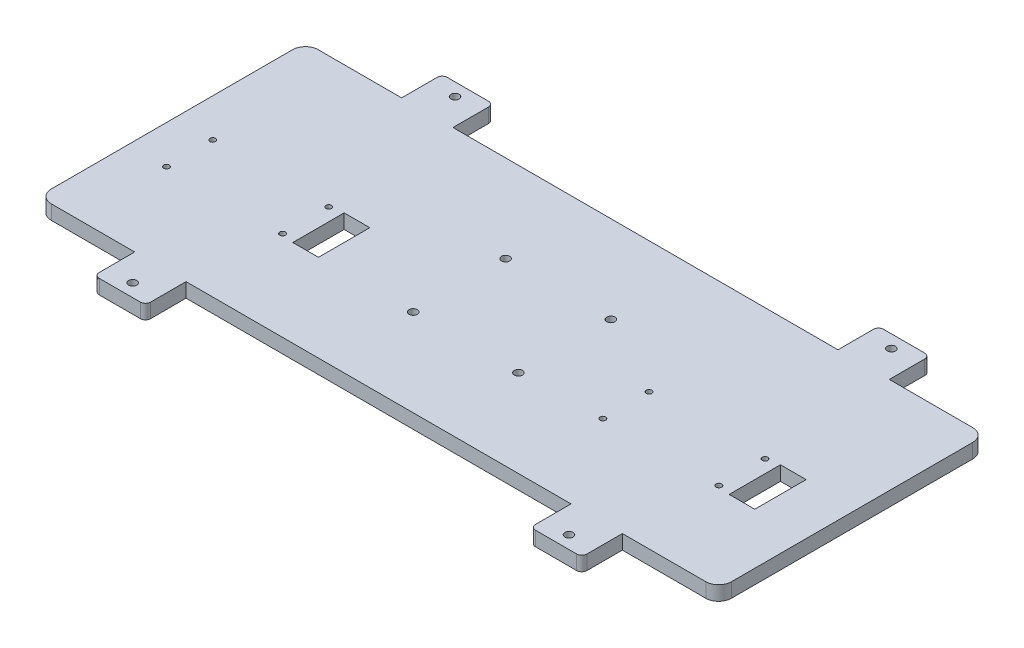
from build123d import *

# Parameters (mm, degrees)
SKETCH_1_W          = 265
SKETCH_1_H          = 104
EXTRUDE_1_DEPTH     = 5.6
SKETCH_2_R          = 1.6
CUT_EXTRUDE_4_DEPTH = 143.448622317
SKETCH_4_R          = 1.1
SKETCH_4_W          = 10
SKETCH_4_H          = 20
CUT_EXTRUDE_6_DEPTH = 143.448622317
SKETCH_5_W          = 20
SKETCH_5_H          = 15.8
SKETCH_5_R          = 1.6
EXTRUDE_2_DEPTH     = 5.6
FILLET_1_R          = 5
FILLET_2_R          = 2


with BuildPart() as part:
    # ｽｹｯﾁ1 → ﾎﾞｽ - 押し出し1 (new body)
    with BuildSketch(Plane(origin=(0, 0, 0), x_dir=(1, 0, 0), z_dir=(0, 1, 0))):
        Rectangle(SKETCH_1_W, SKETCH_1_H)
    extrude(amount=EXTRUDE_1_DEPTH)

    # ｽｹｯﾁ2 → ｶｯﾄ - 押し出し4 (cut, through all)
    with BuildSketch(Plane(origin=(0, 0, 0), x_dir=(1, 0, 0), z_dir=(0, 1, 0))):
        with Locations(Location((20.5, 18, 0), (0, 0, 270))):
            Circle(SKETCH_2_R)
        with Locations(Location((20.5, -18, 0), (0, 0, 90))):
            Circle(SKETCH_2_R)
        with Locations(Location((-20.5, -18, 0), (0, 0, 270))):
            Circle(SKETCH_2_R)
        with Locations(Location((-20.5, 18, 0), (0, 0, 90))):
            Circle(SKETCH_2_R)
    extrude(amount=CUT_EXTRUDE_4_DEPTH, mode=Mode.SUBTRACT)

    # ｽｹｯﾁ4 → ｶｯﾄ - 押し出し6 (cut, through all)
    with BuildSketch(Plane(origin=(0, 5.6, 0), x_dir=(1, 0, 0), z_dir=(0, 1, 0))):
        with Locations(Location((97.6, 1, 0), (0, 0, 270))):
            Circle(SKETCH_4_R)
        with Locations(Location((97.6, -17, 0), (0, 0, 90))):
            Circle(SKETCH_4_R)
        with Locations(Location((52.4, 1, 0), (0, 0, 90))):
            Circle(SKETCH_4_R)
        with Locations(Location((52.4, -17, 0), (0, 0, 270))):
            Circle(SKETCH_4_R)
        with Locations(Location((-72.4, 1, 0), (0, 0, 270))):
            Circle(SKETCH_4_R)
        with Locations(Location((-72.4, -17, 0), (0, 0, 90))):
            Circle(SKETCH_4_R)
        with Locations(Location((-117.6, 1, 0), (0, 0, 90))):
            Circle(SKETCH_4_R)
        with Locations(Location((-117.6, -17, 0), (0, 0, 270))):
            Circle(SKETCH_4_R)
        with Locations((-62.4, -8)):
            Rectangle(SKETCH_4_W, SKETCH_4_H)
        with Locations((107.6, -8)):
            Rectangle(SKETCH_4_W, SKETCH_4_H)
    extrude(amount=-CUT_EXTRUDE_6_DEPTH, mode=Mode.SUBTRACT)

    # ｽｹｯﾁ5 → ﾎﾞｽ - 押し出し2 (add)
    # profile 1 of 4: a face of its own
    with BuildSketch(Plane(origin=(0, 5.6, 0), x_dir=(1, 0, 0), z_dir=(0, 1, 0))):
        with Locations((85, 59.9)):
            Rectangle(SKETCH_5_W, SKETCH_5_H)
        with Locations(Location((85, 62.8, 0), (0, 0, 270))):
            Circle(SKETCH_5_R, mode=Mode.SUBTRACT)
    # profile 2 of 4: a face of its own
    with BuildSketch(Plane(origin=(0, 5.6, 0), x_dir=(1, 0, 0), z_dir=(0, 1, 0))):
        with Locations((-85, 59.9)):
            Rectangle(SKETCH_5_W, SKETCH_5_H)
        with Locations(Location((-85, 62.8, 0), (0, 0, 90))):
            Circle(SKETCH_5_R, mode=Mode.SUBTRACT)
    # profile 3 of 4: a face of its own
    with BuildSketch(Plane(origin=(0, 5.6, 0), x_dir=(1, 0, 0), z_dir=(0, 1, 0))):
        with Locations((85, -59.9)):
            Rectangle(SKETCH_5_W, SKETCH_5_H)
        with Locations(Location((85, -62.8, 0), (0, 0, 90))):
            Circle(SKETCH_5_R, mode=Mode.SUBTRACT)
    # profile 4 of 4: a face of its own
    with BuildSketch(Plane(origin=(0, 5.6, 0), x_dir=(1, 0, 0), z_dir=(0, 1, 0))):
        with Locations((-85, -59.9)):
            Rectangle(SKETCH_5_W, SKETCH_5_H)
        with Locations(Location((-85, -62.8, 0), (0, 0, 270))):
            Circle(SKETCH_5_R, mode=Mode.SUBTRACT)
    extrude(amount=-EXTRUDE_2_DEPTH)

    # ﾌｨﾚｯﾄ1
    fillet_1_edges = [part.edges().sort_by_distance(p)[0] for p in [
        (132.5, 2.8, 52),
        (-132.5, 2.8, 52),
        (-132.5, 2.8, -52),
        (132.5, 2.8, -52),
    ]]
    fillet(fillet_1_edges, radius=FILLET_1_R)

    # ﾌｨﾚｯﾄ2
    fillet_2_edges = [part.edges().sort_by_distance(p)[0] for p in [
        (-95, 2.8, -67.8),
        (-75, 2.8, -67.8),
        (95, 2.8, 67.8),
        (75, 2.8, 67.8),
        (-75, 2.8, 67.8),
        (-95, 2.8, 67.8),
        (75, 2.8, -67.8),
        (95, 2.8, -67.8),
    ]]
    fillet(fillet_2_edges, radius=FILLET_2_R)


solid = part.part
